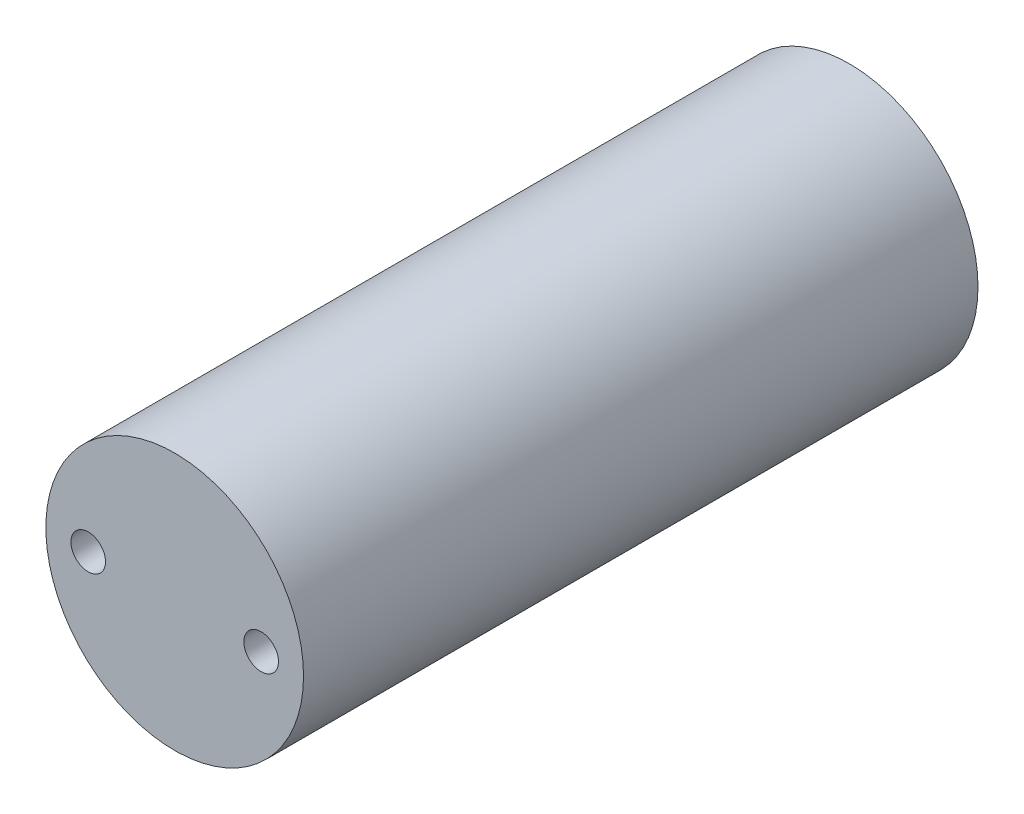
from build123d import *

# Parameters (mm, degrees)
SKETCH1_R           = 7.45
SKETCH1_R_2         = 1
BOSS_EXTRUDE1_DEPTH = 39


with BuildPart() as part:
    # Sketch1 → Boss-Extrude1 (new body)
    with BuildSketch(Plane.XY):
        Circle(SKETCH1_R)
        with Locations((-5, 0)):
            Circle(SKETCH1_R_2, mode=Mode.SUBTRACT)
        with Locations((5, 0)):
            Circle(SKETCH1_R_2, mode=Mode.SUBTRACT)
    extrude(amount=BOSS_EXTRUDE1_DEPTH)


solid = part.part
